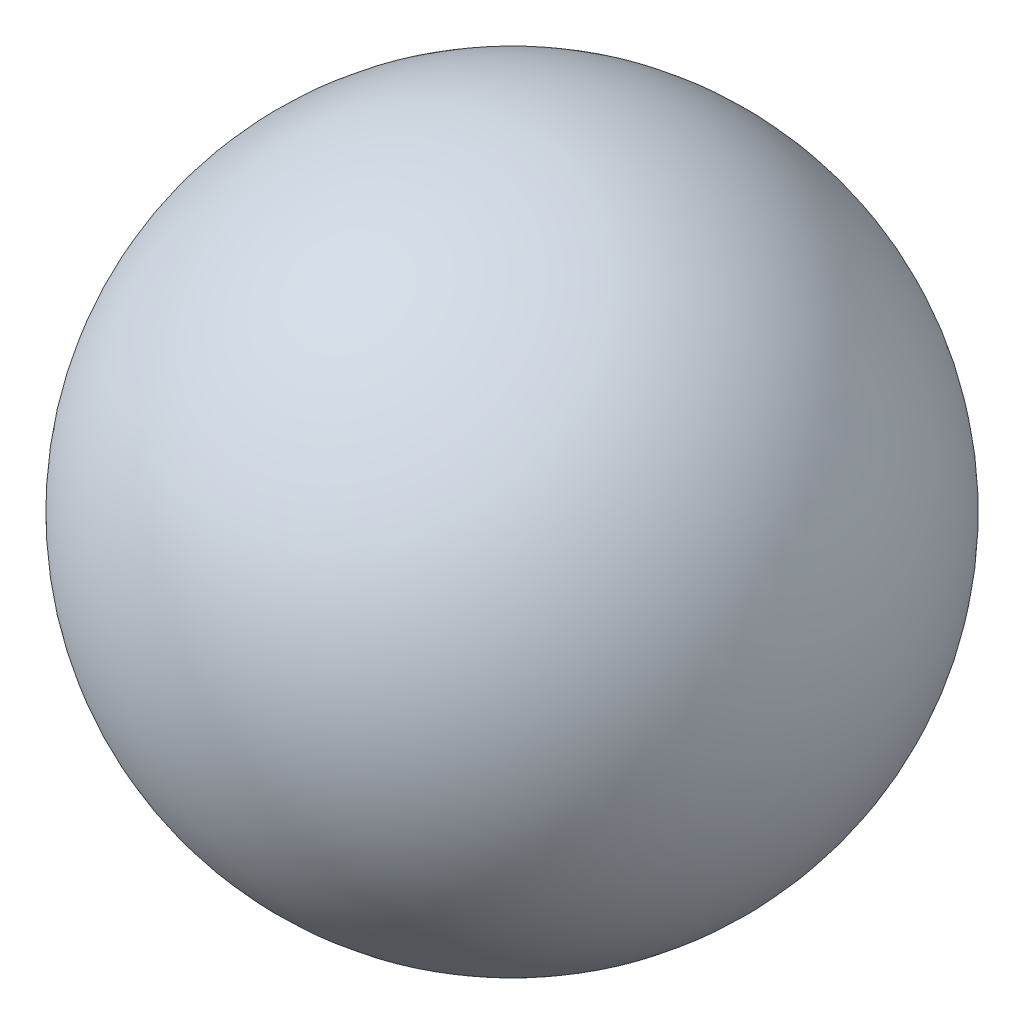
from build123d import *


with BuildPart() as part:
    # Sketch1 → Revolve3 (revolve)
    with BuildSketch(Plane.XY):
        with BuildLine():
            Line((0, 2.778125), (0, -2.778125))
            ThreePointArc((0, -2.778125), (2.778125, 0), (0, 2.778125))
        make_face()
    revolve(axis=Axis((0, 2.778125, 0), (0, -1, 0)))


solid = part.part
